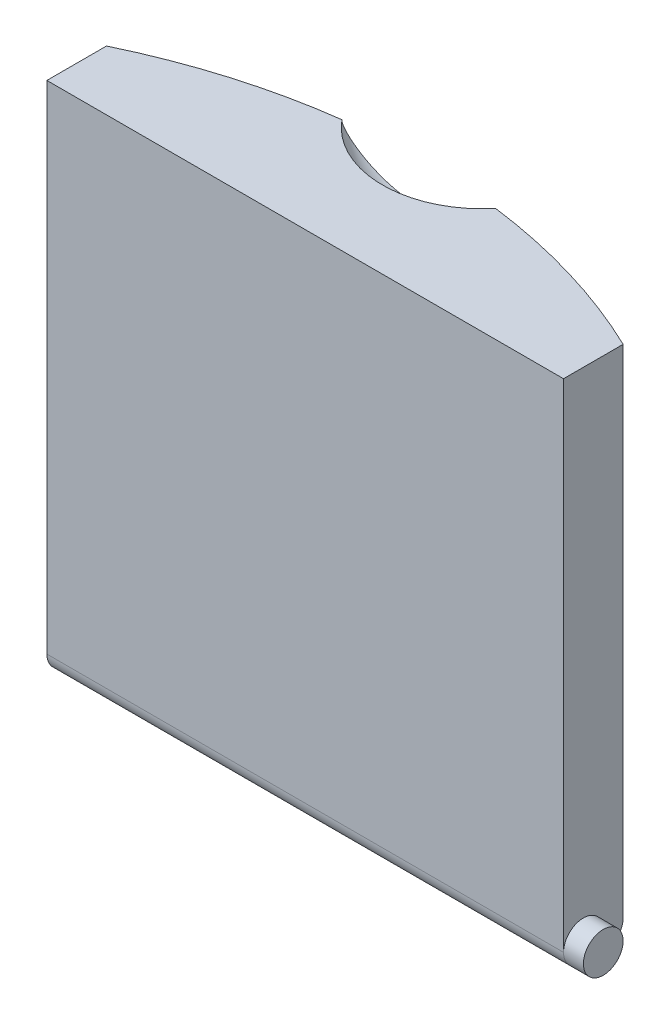
from build123d import *

# Parameters (mm, degrees)
SKETCH1_W           = 260
SKETCH1_H           = 260
BOSS_EXTRUDE1_DEPTH = 30
SKETCH2_R           = 10
BOSS_EXTRUDE2_DEPTH = 10
BOSS_EXTRUDE3_DEPTH = 50
FILLET1_R           = 10


with BuildPart() as part:
    # Sketch1 → Boss-Extrude1 (new body)
    with BuildSketch(Plane.XY):
        with Locations((70.296296296, -67.888888889)):
            Rectangle(SKETCH1_W, SKETCH1_H)
    extrude(amount=BOSS_EXTRUDE1_DEPTH)

    # Sketch2 → Boss-Extrude2 (add)
    with BuildSketch(Plane(origin=(200.296296296, 0, 0), x_dir=(0, 0, -1), z_dir=(1, 0, 0))):
        with Locations(Location((-20, -187.888888889, 0), (0, 0, 180))):
            Circle(SKETCH2_R)
    extrude(amount=BOSS_EXTRUDE2_DEPTH)

    # Sketch3 → Boss-Extrude3 (add)
    with BuildSketch(Plane(origin=(0, 62.111111111, 0), x_dir=(1, 0, 0), z_dir=(0, 1, 0))):
        with BuildLine():
            Line((-59.703703704, 0), (200.296296296, 0))
            ThreePointArc((200.296296296, 0), (70.296296296, 29.629883308), (-59.703703704, 0))
        make_face()
    extrude(amount=-BOSS_EXTRUDE3_DEPTH)

    # Fillet1
    fillet1_edges = [part.edges().sort_by_distance(p)[0] for p in [
        (70.296296296, -197.888888889, 30),
        (70.296296296, -197.888888889, 0),
    ]]
    fillet(fillet1_edges, radius=FILLET1_R)

    # Sketch5 → Cut-Revolve1 (revolve, cut)
    with BuildSketch(Plane(origin=(0, 0, -30), x_dir=(-1, 0, 0), z_dir=(0, 0, -1))):
        with BuildLine():
            Line((-111.130147267, 62.111111111), (-29.462445326, 62.111111111))
            ThreePointArc((-29.462445326, 62.111111111), (-70.296296296, 83.256360811), (-111.130147267, 62.111111111))
        make_face()
    revolve(axis=Axis((111.130147267, 62.111111111, -30), (-1, 0, 0)), mode=Mode.SUBTRACT)

    # Sketch6 → Cut-Revolve2 (revolve, cut)
    with BuildSketch(Plane(origin=(0, 0, -30), x_dir=(-1, 0, 0), z_dir=(0, 0, -1))):
        with BuildLine():
            Line((-168.914289208, 12.111111111), (28.321696616, 12.111111111))
            ThreePointArc((28.321696616, 12.111111111), (-70.296296296, -10.693397865), (-168.914289208, 12.111111111))
        make_face()
    revolve(axis=Axis((168.914289208, 12.111111111, -30), (-1, 0, 0)), mode=Mode.SUBTRACT)


solid = part.part
